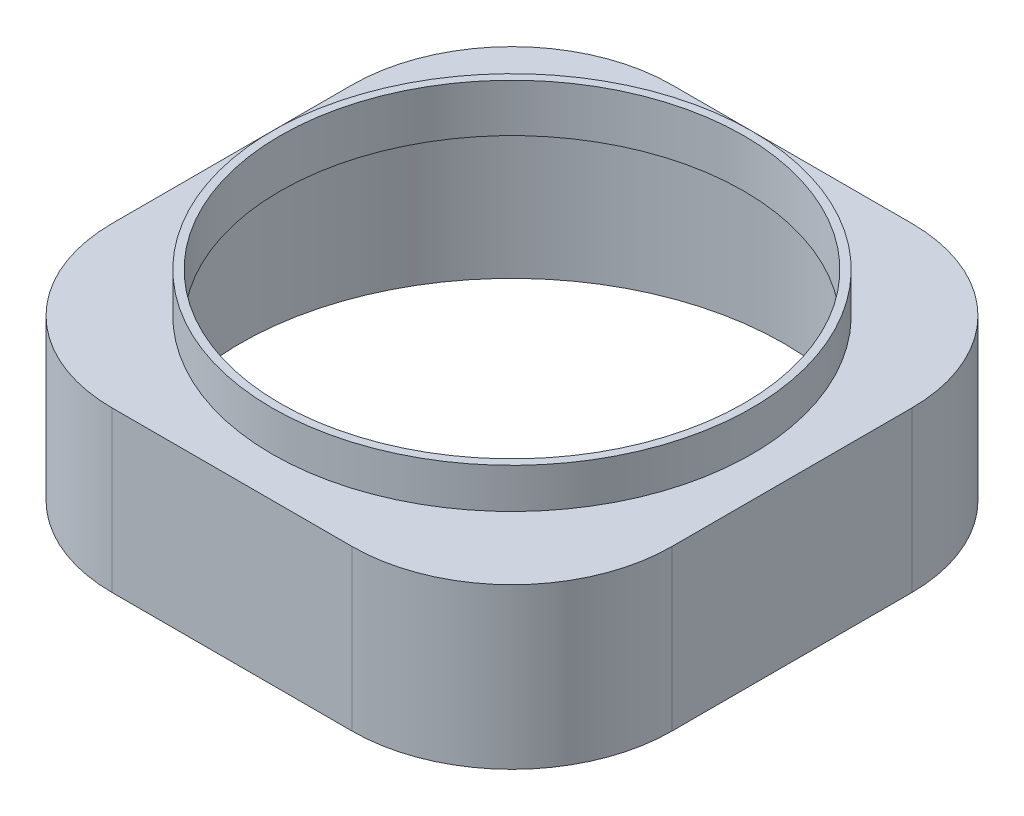
from build123d import *

# Parameters (mm, degrees)
BOSS_EXTRUDE1_DEPTH = 40
SKETCH2_R           = 60
BOSS_EXTRUDE2_DEPTH = 10
SKETCH3_R           = 58
CUT_EXTRUDE1_DEPTH  = 12
SKETCH5_R           = 68
CUT_EXTRUDE3_DEPTH  = 38


with BuildPart() as part:
    # Sketch1 → Boss-Extrude1 (new body)
    with BuildSketch(Plane(origin=(0, 0, 0), x_dir=(1, 0, 0), z_dir=(0, 1, 0))):
        with BuildLine():
            Line((-30, 70), (30, 70))
            ThreePointArc((30, 70), (58.284271247, 58.284271247), (70, 30))
            Line((70, 30), (70, -30))
            ThreePointArc((70, -30), (58.284271247, -58.284271247), (30, -70))
            Line((30, -70), (-30, -70))
            ThreePointArc((-30, -70), (-58.284271247, -58.284271247), (-70, -30))
            Line((-70, -30), (-70, 30))
            ThreePointArc((-70, 30), (-58.284271247, 58.284271247), (-30, 70))
        make_face()
    extrude(amount=-BOSS_EXTRUDE1_DEPTH)

    # Sketch2 → Boss-Extrude2 (add)
    with BuildSketch(Plane(origin=(0, 0, 0), x_dir=(1, 0, 0), z_dir=(0, 1, 0))):
        with Locations(Location((0, 0, 0), (0, 0, 270))):
            Circle(SKETCH2_R)
    extrude(amount=BOSS_EXTRUDE2_DEPTH)

    # Sketch3 → Cut-Extrude1 (cut)
    with BuildSketch(Plane(origin=(0, 10, 0), x_dir=(1, 0, 0), z_dir=(0, 1, 0))):
        with Locations(Location((0, 0, 0), (0, 0, 270))):
            Circle(SKETCH3_R)
    extrude(amount=-CUT_EXTRUDE1_DEPTH, mode=Mode.SUBTRACT)

    # Sketch5 → Cut-Extrude3 (cut)
    with BuildSketch(Plane.XZ.offset(40)):
        with Locations(Location((0, 0, 0), (0, 0, 270))):
            Circle(SKETCH5_R)
    extrude(amount=-CUT_EXTRUDE3_DEPTH, mode=Mode.SUBTRACT)


solid = part.part
